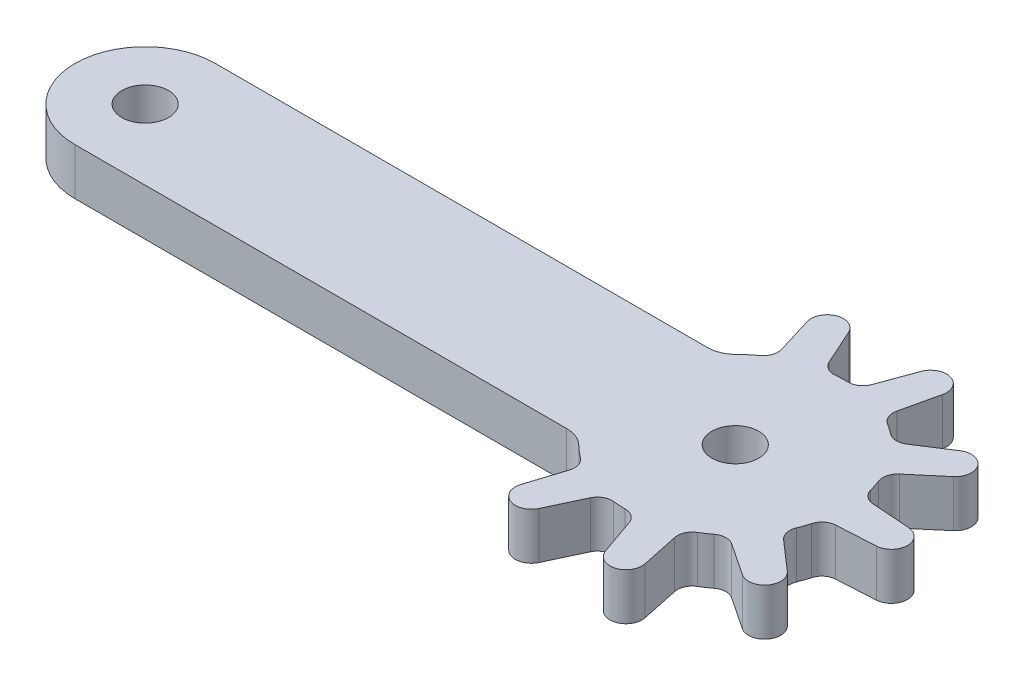
from build123d import *

# Parameters (mm, degrees)
CROQUIS1_R              = 1.5875
SALIENTE_EXTRUIR1_DEPTH = 3.175
SALIENTE_EXTRUIR2_START = -3.175
CROQUIS2_R              = 7.5
CROQUIS2_R_2            = 1.5875
SALIENTE_EXTRUIR2_DEPTH = 3.175
SALIENTE_EXTRUIR3_START = -3.175
SALIENTE_EXTRUIR3_DEPTH = 3.175
CORTAR_EXTRUIR1_START   = -10
CORTAR_EXTRUIR1_DEPTH   = 10
REDONDEO3_R             = 1
MATRIZC2_COUNT          = 7
MATRIZC2_ANGLE          = 222
REDONDEO3_OF_MATRIZC2_R = 1
REDONDEO4_R             = 2


with BuildPart() as part:
    # Croquis1 → Saliente-Extruir1 (new body)
    with BuildSketch(Plane(origin=(0, 0, 0), x_dir=(1, 0, 0), z_dir=(0, 1, 0))):
        with BuildLine():
            Line((-20, 0), (20, 0))
            ThreePointArc((20, 0), (24.7625, -4.7625), (20, -9.525))
            Line((20, -9.525), (-20, -9.525))
            ThreePointArc((-20, -9.525), (-24.7625, -4.7625), (-20, 0))
        make_face()
        with Locations(Location((-20, -4.7625, 0), (0, 0, 270))):
            Circle(CROQUIS1_R, mode=Mode.SUBTRACT)
        with Locations(Location((20, -4.7625, 0), (0, 0, 270))):
            Circle(CROQUIS1_R, mode=Mode.SUBTRACT)
    extrude(amount=SALIENTE_EXTRUIR1_DEPTH)

    # Croquis2 → Saliente-Extruir2 (add)
    with BuildSketch(Plane(origin=(0, 3.175, 0), x_dir=(1, 0, 0), z_dir=(0, 1, 0)).offset(SALIENTE_EXTRUIR2_START)):
        with Locations((20, -4.7625)):
            Circle(CROQUIS2_R)
        with Locations(Location((20, -4.7625, 0), (0, 0, 270))):
            Circle(CROQUIS2_R_2, mode=Mode.SUBTRACT)
    extrude(amount=SALIENTE_EXTRUIR2_DEPTH)

    # Croquis8 → Saliente-Extruir3 (add)
    with BuildSketch(Plane(origin=(0, 3.175, 0), x_dir=(1, 0, 0), z_dir=(0, 1, 0)).offset(SALIENTE_EXTRUIR3_START)):
        with BuildLine():
            Line((14.926688775, 5.835802374), (16.184441281, 1.694396442))
            ThreePointArc((16.184441281, 1.694396442), (17.363636492, 2.258866495), (18.622936274, 2.60999588))
            Line((18.622936274, 2.60999588), (16.844139666, 6.555761596))
            ThreePointArc((16.844139666, 6.555761596), (15.869697171, 6.237640842), (14.926688775, 5.835802374))
        make_face()
    saliente_extruir3 = extrude(amount=SALIENTE_EXTRUIR3_DEPTH)

    # Croquis9 → Cortar-Extruir1 (cut)
    with BuildSketch(Plane(origin=(0, 3.175, 0), x_dir=(1, 0, 0), z_dir=(0, 1, 0)).offset(CORTAR_EXTRUIR1_START)):
        with BuildLine():
            ThreePointArc((16.844139666, 6.555761596), (16.353447772, 6.407332445), (15.869697296, 6.237640889))
            ThreePointArc((15.869697296, 6.237640889), (16.670669085, 6.223682337), (17.245417982, 5.665637219))
            Line((17.245417982, 5.665637219), (16.844139666, 6.555761596))
        make_face()
        with BuildLine():
            ThreePointArc((15.869697296, 6.237640889), (15.393808961, 6.047009892), (14.926688775, 5.835802374))
            Line((14.926688775, 5.835802374), (15.210424872, 4.901543567))
            ThreePointArc((15.210424872, 4.901543567), (15.275853116, 5.699960746), (15.869697296, 6.237640889))
        make_face()
    cortar_extruir1 = extrude(amount=CORTAR_EXTRUIR1_DEPTH, mode=Mode.SUBTRACT)

    # Redondeo3
    redondeo3_edges = [part.edges().sort_by_distance(p)[0] for p in [
        (18.622936274, 1.5875, -2.60999588),
        (16.184441281, 1.5875, -1.694396442),
    ]]
    fillet(redondeo3_edges, radius=REDONDEO3_R)

    # MatrizC2: Saliente-Extruir3, Cortar-Extruir1 ×7 about axis
    matrizc2_axis = Axis((20, 0, 4.7625), (0, -1, 0))
    add([saliente_extruir3.rotate(matrizc2_axis, i * MATRIZC2_ANGLE / (MATRIZC2_COUNT - 1)) for i in range(1, MATRIZC2_COUNT)])
    add([cortar_extruir1.rotate(matrizc2_axis, i * MATRIZC2_ANGLE / (MATRIZC2_COUNT - 1)) for i in range(1, MATRIZC2_COUNT)], mode=Mode.SUBTRACT)

    # Redondeo3 of MatrizC2
    redondeo3_of_matrizc2_edges = [part.edges().sort_by_distance(p)[0] for p in [
        (23.337106788, 1.5875, -1.954174645),
        (20.838616598, 1.5875, -2.690467342),
        (26.707327688, 1.5875, 1.406646118),
        (25.155056708, 1.5875, -0.685012307),
        (27.376313351, 1.5875, 6.118966491),
        (27.395406089, 1.5875, 3.514313802),
        (25.074643863, 1.5875, 10.284998498),
        (26.657411119, 1.5875, 8.216320666),
        (20.729268228, 1.5875, 12.226960319),
        (23.238283761, 1.5875, 11.527373856),
        (16.090195144, 1.5875, 11.16276765),
        (18.515005687, 1.5875, 12.114016299),
    ]]
    fillet(redondeo3_of_matrizc2_edges, radius=REDONDEO3_OF_MATRIZC2_R)

    # Redondeo4
    redondeo4_edges = [part.edges().sort_by_distance(p)[0] for p in [
        (14.206158981, 1.5875, 0),
        (14.206158981, 1.5875, 9.525),
    ]]
    fillet(redondeo4_edges, radius=REDONDEO4_R)


solid = part.part
